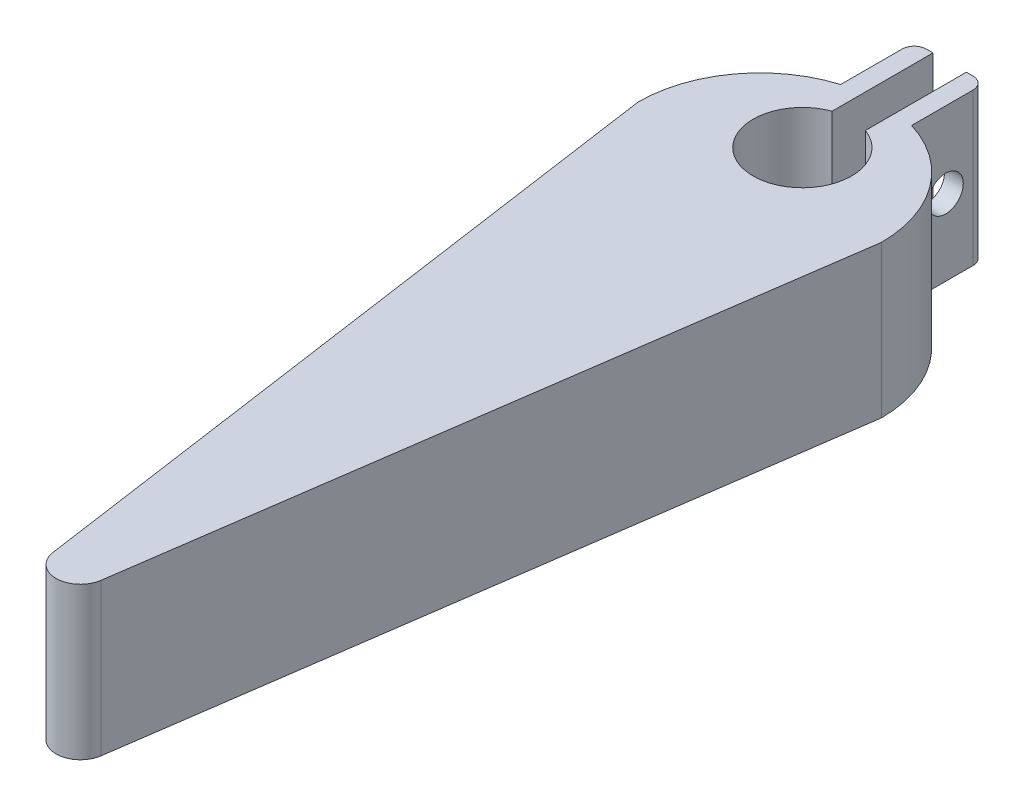
from build123d import *

# Parameters (mm, degrees)
SKETCH2_R           = 4.05
BOSS_EXTRUDE1_DEPTH = 12.5
FILLET1_R           = 2
CUT_EXTRUDE1_DEPTH  = 61.03151231
BOSS_EXTRUDE2_START = -12.5
BOSS_EXTRUDE2_DEPTH = 12.5
FILLET2_R           = 1
SKETCH7_R           = 1.45
CUT_EXTRUDE2_DEPTH  = 61.585751092


with BuildPart() as part:
    # Sketch2 → Boss-Extrude1 (new body)
    with BuildSketch(Plane(origin=(0, 0, 0), x_dir=(1, 0, 0), z_dir=(0, 1, 0))):
        with BuildLine():
            Line((-10, 0), (0, -70))
            Line((0, -70), (10, 0))
            ThreePointArc((10, 0), (0, 10), (-10, 0))
        make_face()
        with Locations(Location((0, 3.5, 0), (0, 0, 270))):
            Circle(SKETCH2_R, mode=Mode.SUBTRACT)
    extrude(amount=BOSS_EXTRUDE1_DEPTH)

    # Fillet1
    fillet1_edges = [part.edges().sort_by_distance(p)[0] for p in [
        (0, 6.25, 70),
    ]]
    fillet(fillet1_edges, radius=FILLET1_R)

    # Sketch5 → Cut-Extrude1 (cut, through all)
    with BuildSketch(Plane(origin=(0, 12.5, 0), x_dir=(1, 0, 0), z_dir=(0, 1, 0))):
        with BuildLine():
            Line((-1.371121558, 3.757662262), (-1.371121558, 13.050926013))
            Line((-1.371121558, 13.050926013), (1.374099614, 13.050926013))
            Line((1.374099614, 13.050926013), (1.374099614, 3.756574271))
            ThreePointArc((1.374099614, 3.756574271), (0.697747417, 3.938673449), (0, 4))
            ThreePointArc((0, 4), (-0.69618638, 3.938949673), (-1.371121558, 3.757662262))
        make_face()
    extrude(amount=-CUT_EXTRUDE1_DEPTH, mode=Mode.SUBTRACT)

    # Sketch6 → Boss-Extrude2 (add)
    with BuildSketch(Plane(origin=(0, 12.5, 0), x_dir=(1, 0, 0), z_dir=(0, 1, 0)).offset(BOSS_EXTRUDE2_START)):
        with BuildLine():
            Line((-2.91788587, 9.564828386), (-2.91788587, 15.613591417))
            Line((-2.91788587, 15.613591417), (-1.371121558, 15.613591417))
            Line((-1.371121558, 15.613591417), (-1.371121558, 9.905555294))
            ThreePointArc((-1.371121558, 9.905555294), (-2.151260069, 9.765862999), (-2.91788587, 9.564828386))
        make_face()
        with BuildLine():
            Line((1.374099614, 9.905142616), (1.374099614, 15.613591417))
            Line((1.374099614, 15.613591417), (2.917072625, 15.613591417))
            Line((2.917072625, 15.613591417), (2.917072625, 9.56507644))
            ThreePointArc((2.917072625, 9.56507644), (2.152312953, 9.765631006), (1.374099614, 9.905142616))
        make_face()
    extrude(amount=BOSS_EXTRUDE2_DEPTH)

    # Fillet2
    fillet2_edges = [part.edges().sort_by_distance(p)[0] for p in [
        (-2.91788587, 6.25, -15.613591417),
        (2.917072625, 6.25, -15.613591417),
    ]]
    fillet(fillet2_edges, radius=FILLET2_R)

    # Sketch7 → Cut-Extrude2 (cut, through all)
    with BuildSketch(Plane(origin=(2.917072625, 0, 0), x_dir=(0, 0, -1), z_dir=(1, 0, 0))):
        with Locations((12.36507644, 6.25)):
            Circle(SKETCH7_R)
    extrude(amount=-CUT_EXTRUDE2_DEPTH, mode=Mode.SUBTRACT)


solid = part.part
